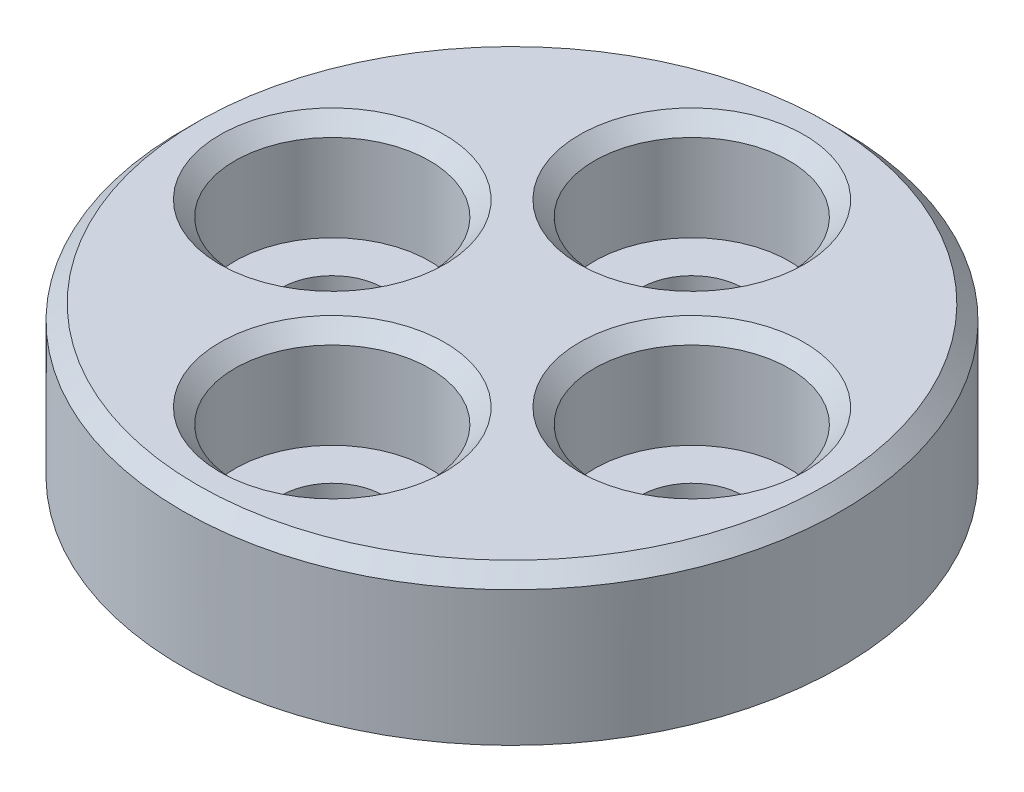
from build123d import *

# Parameters (mm, degrees)
SKETCH1_W                                           = 11
SKETCH1_H                                           = 5
CBORE_FOR_M3_HEX_SOCKET_HEAD_CAP_SCREW1_D           = 3.4
CBORE_FOR_M3_HEX_SOCKET_HEAD_CAP_SCREW1_DEPTH       = 11
CBORE_FOR_M3_HEX_SOCKET_HEAD_CAP_SCREW1_CBORE_D     = 6.5
CBORE_FOR_M3_HEX_SOCKET_HEAD_CAP_SCREW1_CBORE_DEPTH = 3.4
CBORE_FOR_M3_HEX_SOCKET_HEAD_CAP_SCREW1_TIP         = 1.021463052
CHAMFER1_SIZE                                       = 0.5


with BuildPart() as part:
    # Sketch1 → Revolve1 (revolve)
    with BuildSketch(Plane.XY, mode=Mode.PRIVATE) as revolve1_sk:
        with Locations((5.5, 2.5)):
            Rectangle(SKETCH1_W, SKETCH1_H)
    revolve(revolve1_sk.sketch.rotate(Axis((0, 0, 0), (0, 1, 0)), 90), axis=Axis((0, 0, 0), (0, 1, 0)))

    # CBORE for M3 Hex Socket Head Cap Screw1
    with Locations(Plane(origin=(0, 5, 0), x_dir=(1, 0, 0), z_dir=(0, 1, 0))):
        with Locations((-6, 0), (0, 6), (6, 0), (0, -6)):
            CounterBoreHole(CBORE_FOR_M3_HEX_SOCKET_HEAD_CAP_SCREW1_D / 2, CBORE_FOR_M3_HEX_SOCKET_HEAD_CAP_SCREW1_CBORE_D / 2, CBORE_FOR_M3_HEX_SOCKET_HEAD_CAP_SCREW1_CBORE_DEPTH, depth=CBORE_FOR_M3_HEX_SOCKET_HEAD_CAP_SCREW1_DEPTH)
            with Locations((0, 0, -(CBORE_FOR_M3_HEX_SOCKET_HEAD_CAP_SCREW1_DEPTH + CBORE_FOR_M3_HEX_SOCKET_HEAD_CAP_SCREW1_TIP / 2))):  # 118° drill point
                Cone(0, CBORE_FOR_M3_HEX_SOCKET_HEAD_CAP_SCREW1_D / 2, CBORE_FOR_M3_HEX_SOCKET_HEAD_CAP_SCREW1_TIP, mode=Mode.SUBTRACT)

    # Chamfer1
    chamfer1_edges = [part.edges().sort_by_distance(p)[0] for p in [
        (-4.3, 0, 0),
        (-9.25, 5, 0),
        (1.7, 0, 6),
        (-3.25, 5, 6),
        (7.7, 0, 0),
        (2.75, 5, 0),
        (1.7, 0, -6),
        (-3.25, 5, -6),
        (0, 5, 11),
    ]]
    chamfer(chamfer1_edges, length=CHAMFER1_SIZE)


solid = part.part
